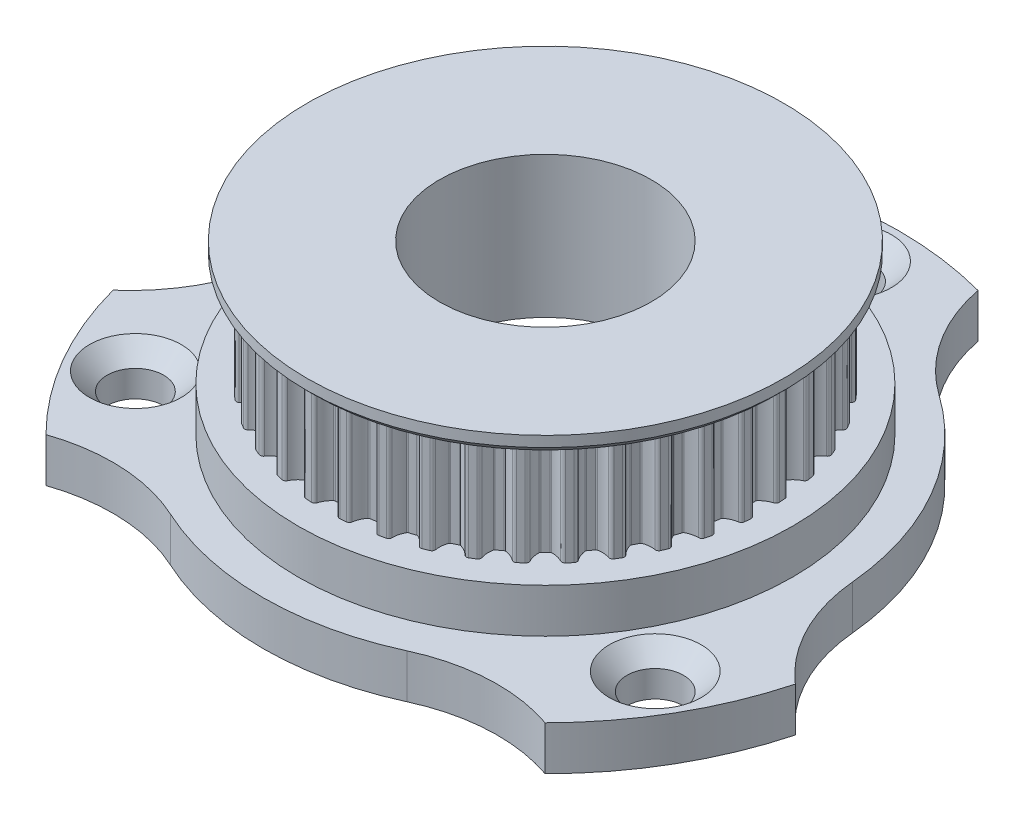
from build123d import *

# Parameters (mm, degrees)
SKETCH1_R           = 13
SKETCH1_R_2         = 1.6
BOSS_EXTRUDE1_DEPTH = 4
SKETCH2_R           = 14
BOSS_EXTRUDE2_DEPTH = 1
SKETCH3_R           = 1
BOSS_EXTRUDE3_DEPTH = 6
SKETCH4_R           = 13.5
BOSS_EXTRUDE4_DEPTH = 1
SKETCH5_R           = 6
CUT_EXTRUDE1_DEPTH  = 31.287074776
CHAMFER1_SIZE       = 0.4
CUT_EXTRUDE2_START  = -1.5
SKETCH6_R           = 14
CUT_EXTRUDE2_DEPTH  = 1.5
CHAMFER2_SIZE       = 1


with BuildPart() as part:
    # Sketch1 → Boss-Extrude1 (new body)
    with BuildSketch(Plane(origin=(0, 0, 0), x_dir=(1, 0, 0), z_dir=(0, 1, 0))):
        with BuildLine():
            ThreePointArc((-9.230769231, 13.068775743), (-6.605710649, 15.8020659), (-5.186223756, 19.315876453))
            ThreePointArc((-5.186223756, 19.315876453), (0, 20), (5.186223756, 19.315876453))
            ThreePointArc((5.186223756, 19.315876453), (6.605710649, 15.8020659), (9.230769231, 13.068775743))
            ThreePointArc((9.230769231, 13.068775743), (13.856406461, 8), (15.933276405, 1.459692779))
            ThreePointArc((15.933276405, 1.459692779), (16.987845826, -2.180319718), (19.321151583, -5.166536704))
            ThreePointArc((19.321151583, -5.166536704), (17.320508076, -10), (14.134927827, -14.149339749))
            ThreePointArc((14.134927827, -14.149339749), (10.382135177, -13.621746182), (6.702507174, -14.528468522))
            ThreePointArc((6.702507174, -14.528468522), (0, -16), (-6.702507174, -14.528468522))
            ThreePointArc((-6.702507174, -14.528468522), (-10.382135177, -13.621746182), (-14.134927827, -14.149339749))
            ThreePointArc((-14.134927827, -14.149339749), (-17.320508076, -10), (-19.321151583, -5.166536704))
            ThreePointArc((-19.321151583, -5.166536704), (-16.987845826, -2.180319718), (-15.933276405, 1.459692779))
            ThreePointArc((-15.933276405, 1.459692779), (-13.856406461, 8), (-9.230769231, 13.068775743))
        make_face()
        with Locations(Location((0, 0, 0), (0, 0, 270))):
            Circle(SKETCH1_R, mode=Mode.SUBTRACT)
        with Locations(Location((0, 17, 0), (0, 0, 270))):
            Circle(SKETCH1_R_2, mode=Mode.SUBTRACT)
        with Locations(Location((14.722431864, -8.5, 0), (0, 0, 270))):
            Circle(SKETCH1_R_2, mode=Mode.SUBTRACT)
        with Locations(Location((-14.722431864, -8.5, 0), (0, 0, 270))):
            Circle(SKETCH1_R_2, mode=Mode.SUBTRACT)
    extrude(amount=BOSS_EXTRUDE1_DEPTH)

    # Sketch2 → Boss-Extrude2 (add)
    with BuildSketch(Plane(origin=(0, 4, 0), x_dir=(1, 0, 0), z_dir=(0, 1, 0))):
        with Locations(Location((0, 0, 0), (0, 0, 270))):
            Circle(SKETCH2_R)
    extrude(amount=BOSS_EXTRUDE2_DEPTH)

    # Sketch3 → Boss-Extrude3 (add)
    with BuildSketch(Plane(origin=(0, 5, 0), x_dir=(1, 0, 0), z_dir=(0, 1, 0))):
        with BuildLine():
            ThreePointArc((0.807933899, 12.451816205), (0.688175478, 12.418909415), (0.614331313, 12.319049635))
            ThreePointArc((0.614331313, 12.319049635), (0.469945289, 12.007338122), (0.250277641, 11.74322164))
            ThreePointArc((0.250277641, 11.74322164), (0.218101357, 11.723209413), (0.180789324, 11.716605277))
            ThreePointArc((0.180789324, 11.716605277), (0, 11.718), (-0.180789324, 11.716605277))
            ThreePointArc((-0.180789324, 11.716605277), (-0.218101357, 11.723209413), (-0.250277641, 11.74322164))
            ThreePointArc((-0.250277641, 11.74322164), (-0.469945289, 12.007338122), (-0.614331313, 12.319049635))
            ThreePointArc((-0.614331313, 12.319049635), (-0.688175478, 12.418909415), (-0.807933899, 12.451816205))
            ThreePointArc((-0.807933899, 12.451816205), (-0.979012596, 12.43953449), (-1.149906315, 12.424902393))
            ThreePointArc((-1.149906315, 12.424902393), (-1.263042555, 12.373666395), (-1.320356064, 12.263484282))
            ThreePointArc((-1.320356064, 12.263484282), (-1.414202033, 11.933023504), (-1.589848288, 11.637795144))
            ThreePointArc((-1.589848288, 11.637795144), (-1.618497825, 11.61299582), (-1.654317371, 11.600636105))
            ThreePointArc((-1.654317371, 11.600636105), (-1.833099061, 11.573731975), (-2.011444386, 11.544072742))
            ThreePointArc((-2.011444386, 11.544072742), (-2.049330161, 11.544758682), (-2.084240903, 11.559491046))
            ThreePointArc((-2.084240903, 11.559491046), (-2.342520998, 11.785992224), (-2.533891814, 12.071279101))
            ThreePointArc((-2.533891814, 12.071279101), (-2.622448347, 12.158357669), (-2.745880099, 12.172124978))
            ThreePointArc((-2.745880099, 12.172124978), (-2.91293125, 12.133231867), (-3.079432019, 12.092046247))
            ThreePointArc((-3.079432019, 12.092046247), (-3.183160288, 12.023742642), (-3.222531894, 11.905951246))
            ThreePointArc((-3.222531894, 11.905951246), (-3.263527007, 11.564878245), (-3.390826875, 11.245807507))
            ThreePointArc((-3.390826875, 11.245807507), (-3.41524422, 11.21683173), (-3.448689282, 11.199020771))
            ThreePointArc((-3.448689282, 11.199020771), (-3.62106114, 11.144480258), (-3.792571012, 11.087286824))
            ThreePointArc((-3.792571012, 11.087286824), (-3.830097654, 11.082037678), (-3.866883236, 11.091127419))
            ThreePointArc((-3.866883236, 11.091127419), (-4.157416066, 11.274436083), (-4.39105949, 11.526273614))
            ThreePointArc((-4.39105949, 11.526273614), (-4.492147834, 11.598426806), (-4.616213618, 11.592715637))
            ThreePointArc((-4.616213618, 11.592715637), (-4.775123869, 11.528168807), (-4.933131886, 11.461443792))
            ThreePointArc((-4.933131886, 11.461443792), (-5.024898051, 11.377754441), (-5.045358292, 11.255254176))
            ThreePointArc((-5.045358292, 11.255254176), (-5.032493116, 10.911967301), (-5.10831205, 10.576910767))
            ThreePointArc((-5.10831205, 10.576910767), (-5.127895967, 10.544472015), (-5.158143018, 10.521648379))
            ThreePointArc((-5.158143018, 10.521648379), (-5.319860676, 10.44081445), (-5.480311952, 10.357495108))
            ThreePointArc((-5.480311952, 10.357495108), (-5.516555432, 10.346440127), (-5.554310072, 10.349663425))
            ThreePointArc((-5.554310072, 10.349663425), (-5.869941753, 10.485265908), (-6.140104708, 10.697453017))
            ThreePointArc((-6.140104708, 10.697453017), (-6.251235732, 10.752904183), (-6.372880637, 10.727855162))
            ThreePointArc((-6.372880637, 10.727855162), (-6.519737091, 10.639243971), (-6.665361675, 10.548622552))
            ThreePointArc((-6.665361675, 10.548622552), (-6.742906147, 10.451608165), (-6.743951225, 10.327415395))
            ThreePointArc((-6.743951225, 10.327415395), (-6.677542542, 9.990367508), (-6.70001363, 9.647575382))
            ThreePointArc((-6.70001363, 9.647575382), (-6.714281898, 9.612472405), (-6.740586153, 9.585198084))
            ThreePointArc((-6.740586153, 9.585198084), (-6.887667586, 9.48006114), (-7.033109424, 9.372667487))
            ThreePointArc((-7.033109424, 9.372667487), (-7.067177307, 9.356078882), (-7.104971359, 9.353356369))
            ThreePointArc((-7.104971359, 9.353356369), (-7.437929992, 9.437913687), (-7.73796017, 9.605225624))
            ThreePointArc((-7.73796017, 9.605225624), (-7.85639746, 9.642609371), (-7.972626185, 9.59883929))
            ThreePointArc((-7.972626185, 9.59883929), (-8.103812747, 9.488345639), (-8.233468138, 9.376059216))
            ThreePointArc((-8.233468138, 9.376059216), (-8.294881515, 9.268108609), (-8.276485697, 9.145281372))
            ThreePointArc((-8.276485697, 9.145281372), (-8.158168709, 8.82277171), (-8.126738638, 8.480684672))
            ThreePointArc((-8.126738638, 8.480684672), (-8.135339924, 8.443781822), (-8.157053687, 8.412728401))
            ThreePointArc((-8.157053687, 8.412728401), (-8.285877262, 8.285877262), (-8.412728401, 8.157053687))
            ThreePointArc((-8.412728401, 8.157053687), (-8.443781822, 8.135339924), (-8.480684672, 8.126738638))
            ThreePointArc((-8.480684672, 8.126738638), (-8.82277171, 8.158168709), (-9.145281372, 8.276485697))
            ThreePointArc((-9.145281372, 8.276485697), (-9.268108609, 8.294881515), (-9.376059216, 8.233468138))
            ThreePointArc((-9.376059216, 8.233468138), (-9.488345639, 8.103812747), (-9.59883929, 7.972626185))
            ThreePointArc((-9.59883929, 7.972626185), (-9.642609371, 7.85639746), (-9.605225624, 7.73796017))
            ThreePointArc((-9.605225624, 7.73796017), (-9.437913687, 7.437929992), (-9.353356369, 7.104971359))
            ThreePointArc((-9.353356369, 7.104971359), (-9.356078882, 7.067177307), (-9.372667487, 7.033109424))
            ThreePointArc((-9.372667487, 7.033109424), (-9.48006114, 6.887667586), (-9.585198084, 6.740586153))
            ThreePointArc((-9.585198084, 6.740586153), (-9.612472405, 6.714281898), (-9.647575382, 6.70001363))
            ThreePointArc((-9.647575382, 6.70001363), (-9.990367508, 6.677542542), (-10.327415395, 6.743951225))
            ThreePointArc((-10.327415395, 6.743951225), (-10.451608165, 6.742906147), (-10.548622552, 6.665361675))
            ThreePointArc((-10.548622552, 6.665361675), (-10.639243971, 6.519737091), (-10.727855162, 6.372880637))
            ThreePointArc((-10.727855162, 6.372880637), (-10.752904183, 6.251235732), (-10.697453017, 6.140104708))
            ThreePointArc((-10.697453017, 6.140104708), (-10.485265908, 5.869941753), (-10.349663425, 5.554310072))
            ThreePointArc((-10.349663425, 5.554310072), (-10.346440127, 5.516555432), (-10.357495108, 5.480311952))
            ThreePointArc((-10.357495108, 5.480311952), (-10.44081445, 5.319860676), (-10.521648379, 5.158143018))
            ThreePointArc((-10.521648379, 5.158143018), (-10.544472015, 5.127895967), (-10.576910767, 5.10831205))
            ThreePointArc((-10.576910767, 5.10831205), (-10.911967301, 5.032493116), (-11.255254176, 5.045358292))
            ThreePointArc((-11.255254176, 5.045358292), (-11.377754441, 5.024898051), (-11.461443792, 4.933131886))
            ThreePointArc((-11.461443792, 4.933131886), (-11.528168807, 4.775123869), (-11.592715637, 4.616213618))
            ThreePointArc((-11.592715637, 4.616213618), (-11.598426806, 4.492147834), (-11.526273614, 4.39105949))
            ThreePointArc((-11.526273614, 4.39105949), (-11.274436083, 4.157416066), (-11.091127419, 3.866883236))
            ThreePointArc((-11.091127419, 3.866883236), (-11.082037678, 3.830097654), (-11.087286824, 3.792571012))
            ThreePointArc((-11.087286824, 3.792571012), (-11.144480258, 3.62106114), (-11.199020771, 3.448689282))
            ThreePointArc((-11.199020771, 3.448689282), (-11.21683173, 3.41524422), (-11.245807507, 3.390826875))
            ThreePointArc((-11.245807507, 3.390826875), (-11.564878245, 3.263527007), (-11.905951246, 3.222531894))
            ThreePointArc((-11.905951246, 3.222531894), (-12.023742642, 3.183160288), (-12.092046247, 3.079432019))
            ThreePointArc((-12.092046247, 3.079432019), (-12.133231867, 2.91293125), (-12.172124978, 2.745880099))
            ThreePointArc((-12.172124978, 2.745880099), (-12.158357669, 2.622448347), (-12.071279101, 2.533891814))
            ThreePointArc((-12.071279101, 2.533891814), (-11.785992224, 2.342520998), (-11.559491046, 2.084240903))
            ThreePointArc((-11.559491046, 2.084240903), (-11.544758682, 2.049330161), (-11.544072742, 2.011444386))
            ThreePointArc((-11.544072742, 2.011444386), (-11.573731975, 1.833099061), (-11.600636105, 1.654317371))
            ThreePointArc((-11.600636105, 1.654317371), (-11.61299582, 1.618497825), (-11.637795144, 1.589848288))
            ThreePointArc((-11.637795144, 1.589848288), (-11.933023504, 1.414202033), (-12.263484282, 1.320356064))
            ThreePointArc((-12.263484282, 1.320356064), (-12.373666395, 1.263042555), (-12.424902393, 1.149906315))
            ThreePointArc((-12.424902393, 1.149906315), (-12.43953449, 0.979012596), (-12.451816205, 0.807933899))
            ThreePointArc((-12.451816205, 0.807933899), (-12.418909415, 0.688175478), (-12.319049635, 0.614331313))
            ThreePointArc((-12.319049635, 0.614331313), (-12.007338122, 0.469945289), (-11.74322164, 0.250277641))
            ThreePointArc((-11.74322164, 0.250277641), (-11.723209413, 0.218101357), (-11.716605277, 0.180789324))
            ThreePointArc((-11.716605277, 0.180789324), (-11.718, 0), (-11.716605277, -0.180789324))
            ThreePointArc((-11.716605277, -0.180789324), (-11.723209413, -0.218101357), (-11.74322164, -0.250277641))
            ThreePointArc((-11.74322164, -0.250277641), (-12.007338122, -0.469945289), (-12.319049635, -0.614331313))
            ThreePointArc((-12.319049635, -0.614331313), (-12.418909415, -0.688175478), (-12.451816205, -0.807933899))
            ThreePointArc((-12.451816205, -0.807933899), (-12.43953449, -0.979012596), (-12.424902393, -1.149906315))
            ThreePointArc((-12.424902393, -1.149906315), (-12.373666395, -1.263042555), (-12.263484282, -1.320356064))
            ThreePointArc((-12.263484282, -1.320356064), (-11.933023504, -1.414202033), (-11.637795144, -1.589848288))
            ThreePointArc((-11.637795144, -1.589848288), (-11.61299582, -1.618497825), (-11.600636105, -1.654317371))
            ThreePointArc((-11.600636105, -1.654317371), (-11.573731975, -1.833099061), (-11.544072742, -2.011444386))
            ThreePointArc((-11.544072742, -2.011444386), (-11.544758682, -2.049330161), (-11.559491046, -2.084240903))
            ThreePointArc((-11.559491046, -2.084240903), (-11.785992224, -2.342520998), (-12.071279101, -2.533891814))
            ThreePointArc((-12.071279101, -2.533891814), (-12.158357669, -2.622448347), (-12.172124978, -2.745880099))
            ThreePointArc((-12.172124978, -2.745880099), (-12.133231867, -2.91293125), (-12.092046247, -3.079432019))
            ThreePointArc((-12.092046247, -3.079432019), (-12.023742642, -3.183160288), (-11.905951246, -3.222531894))
            ThreePointArc((-11.905951246, -3.222531894), (-11.564878245, -3.263527007), (-11.245807507, -3.390826875))
            ThreePointArc((-11.245807507, -3.390826875), (-11.21683173, -3.41524422), (-11.199020771, -3.448689282))
            ThreePointArc((-11.199020771, -3.448689282), (-11.144480258, -3.62106114), (-11.087286824, -3.792571012))
            ThreePointArc((-11.087286824, -3.792571012), (-11.082037678, -3.830097654), (-11.091127419, -3.866883236))
            ThreePointArc((-11.091127419, -3.866883236), (-11.274436083, -4.157416066), (-11.526273614, -4.39105949))
            ThreePointArc((-11.526273614, -4.39105949), (-11.598426806, -4.492147834), (-11.592715637, -4.616213618))
            ThreePointArc((-11.592715637, -4.616213618), (-11.528168807, -4.775123869), (-11.461443792, -4.933131886))
            ThreePointArc((-11.461443792, -4.933131886), (-11.377754441, -5.024898051), (-11.255254176, -5.045358292))
            ThreePointArc((-11.255254176, -5.045358292), (-10.911967301, -5.032493116), (-10.576910767, -5.10831205))
            ThreePointArc((-10.576910767, -5.10831205), (-10.544472015, -5.127895967), (-10.521648379, -5.158143018))
            ThreePointArc((-10.521648379, -5.158143018), (-10.44081445, -5.319860676), (-10.357495108, -5.480311952))
            ThreePointArc((-10.357495108, -5.480311952), (-10.346440127, -5.516555432), (-10.349663425, -5.554310072))
            ThreePointArc((-10.349663425, -5.554310072), (-10.485265908, -5.869941753), (-10.697453017, -6.140104708))
            ThreePointArc((-10.697453017, -6.140104708), (-10.752904183, -6.251235732), (-10.727855162, -6.372880637))
            ThreePointArc((-10.727855162, -6.372880637), (-10.639243971, -6.519737091), (-10.548622552, -6.665361675))
            ThreePointArc((-10.548622552, -6.665361675), (-10.451608165, -6.742906147), (-10.327415395, -6.743951225))
            ThreePointArc((-10.327415395, -6.743951225), (-9.990367508, -6.677542542), (-9.647575382, -6.70001363))
            ThreePointArc((-9.647575382, -6.70001363), (-9.612472405, -6.714281898), (-9.585198084, -6.740586153))
            ThreePointArc((-9.585198084, -6.740586153), (-9.48006114, -6.887667586), (-9.372667487, -7.033109424))
            ThreePointArc((-9.372667487, -7.033109424), (-9.356078882, -7.067177307), (-9.353356369, -7.104971359))
            ThreePointArc((-9.353356369, -7.104971359), (-9.437913687, -7.437929992), (-9.605225624, -7.73796017))
            ThreePointArc((-9.605225624, -7.73796017), (-9.642609371, -7.85639746), (-9.59883929, -7.972626185))
            ThreePointArc((-9.59883929, -7.972626185), (-9.488345639, -8.103812747), (-9.376059216, -8.233468138))
            ThreePointArc((-9.376059216, -8.233468138), (-9.268108609, -8.294881515), (-9.145281372, -8.276485697))
            ThreePointArc((-9.145281372, -8.276485697), (-8.82277171, -8.158168709), (-8.480684672, -8.126738638))
            ThreePointArc((-8.480684672, -8.126738638), (-8.443781822, -8.135339924), (-8.412728401, -8.157053687))
            ThreePointArc((-8.412728401, -8.157053687), (-8.285877262, -8.285877262), (-8.157053687, -8.412728401))
            ThreePointArc((-8.157053687, -8.412728401), (-8.135339924, -8.443781822), (-8.126738638, -8.480684672))
            ThreePointArc((-8.126738638, -8.480684672), (-8.158168709, -8.82277171), (-8.276485697, -9.145281372))
            ThreePointArc((-8.276485697, -9.145281372), (-8.294881515, -9.268108609), (-8.233468138, -9.376059216))
            ThreePointArc((-8.233468138, -9.376059216), (-8.103812747, -9.488345639), (-7.972626185, -9.59883929))
            ThreePointArc((-7.972626185, -9.59883929), (-7.85639746, -9.642609371), (-7.73796017, -9.605225624))
            ThreePointArc((-7.73796017, -9.605225624), (-7.437929992, -9.437913687), (-7.104971359, -9.353356369))
            ThreePointArc((-7.104971359, -9.353356369), (-7.067177307, -9.356078882), (-7.033109424, -9.372667487))
            ThreePointArc((-7.033109424, -9.372667487), (-6.887667586, -9.48006114), (-6.740586153, -9.585198084))
            ThreePointArc((-6.740586153, -9.585198084), (-6.714281898, -9.612472405), (-6.70001363, -9.647575382))
            ThreePointArc((-6.70001363, -9.647575382), (-6.677542542, -9.990367508), (-6.743951225, -10.327415395))
            ThreePointArc((-6.743951225, -10.327415395), (-6.742906147, -10.451608165), (-6.665361675, -10.548622552))
            ThreePointArc((-6.665361675, -10.548622552), (-6.519737091, -10.639243971), (-6.372880637, -10.727855162))
            ThreePointArc((-6.372880637, -10.727855162), (-6.251235732, -10.752904183), (-6.140104708, -10.697453017))
            ThreePointArc((-6.140104708, -10.697453017), (-5.869941753, -10.485265908), (-5.554310072, -10.349663425))
            ThreePointArc((-5.554310072, -10.349663425), (-5.516555432, -10.346440127), (-5.480311952, -10.357495108))
            ThreePointArc((-5.480311952, -10.357495108), (-5.319860676, -10.44081445), (-5.158143018, -10.521648379))
            ThreePointArc((-5.158143018, -10.521648379), (-5.127895967, -10.544472015), (-5.10831205, -10.576910767))
            ThreePointArc((-5.10831205, -10.576910767), (-5.032493116, -10.911967301), (-5.045358292, -11.255254176))
            ThreePointArc((-5.045358292, -11.255254176), (-5.024898051, -11.377754441), (-4.933131886, -11.461443792))
            ThreePointArc((-4.933131886, -11.461443792), (-4.775123869, -11.528168807), (-4.616213618, -11.592715637))
            ThreePointArc((-4.616213618, -11.592715637), (-4.492147834, -11.598426806), (-4.39105949, -11.526273614))
            ThreePointArc((-4.39105949, -11.526273614), (-4.157416066, -11.274436083), (-3.866883236, -11.091127419))
            ThreePointArc((-3.866883236, -11.091127419), (-3.830097654, -11.082037678), (-3.792571012, -11.087286824))
            ThreePointArc((-3.792571012, -11.087286824), (-3.62106114, -11.144480258), (-3.448689282, -11.199020771))
            ThreePointArc((-3.448689282, -11.199020771), (-3.41524422, -11.21683173), (-3.390826875, -11.245807507))
            ThreePointArc((-3.390826875, -11.245807507), (-3.263527007, -11.564878245), (-3.222531894, -11.905951246))
            ThreePointArc((-3.222531894, -11.905951246), (-3.183160288, -12.023742642), (-3.079432019, -12.092046247))
            ThreePointArc((-3.079432019, -12.092046247), (-2.91293125, -12.133231867), (-2.745880099, -12.172124978))
            ThreePointArc((-2.745880099, -12.172124978), (-2.622448347, -12.158357669), (-2.533891814, -12.071279101))
            ThreePointArc((-2.533891814, -12.071279101), (-2.342520998, -11.785992224), (-2.084240903, -11.559491046))
            ThreePointArc((-2.084240903, -11.559491046), (-2.049330161, -11.544758682), (-2.011444386, -11.544072742))
            ThreePointArc((-2.011444386, -11.544072742), (-1.833099061, -11.573731975), (-1.654317371, -11.600636105))
            ThreePointArc((-1.654317371, -11.600636105), (-1.618497825, -11.61299582), (-1.589848288, -11.637795144))
            ThreePointArc((-1.589848288, -11.637795144), (-1.414202033, -11.933023504), (-1.320356064, -12.263484282))
            ThreePointArc((-1.320356064, -12.263484282), (-1.263042555, -12.373666395), (-1.149906315, -12.424902393))
            ThreePointArc((-1.149906315, -12.424902393), (-0.979012596, -12.43953449), (-0.807933899, -12.451816205))
            ThreePointArc((-0.807933899, -12.451816205), (-0.688175478, -12.418909415), (-0.614331313, -12.319049635))
            ThreePointArc((-0.614331313, -12.319049635), (-0.469945289, -12.007338122), (-0.250277641, -11.74322164))
            ThreePointArc((-0.250277641, -11.74322164), (-0.218101357, -11.723209413), (-0.180789324, -11.716605277))
            ThreePointArc((-0.180789324, -11.716605277), (0, -11.718), (0.180789324, -11.716605277))
            ThreePointArc((0.180789324, -11.716605277), (0.218101357, -11.723209413), (0.250277641, -11.74322164))
            ThreePointArc((0.250277641, -11.74322164), (0.469945289, -12.007338122), (0.614331313, -12.319049635))
            ThreePointArc((0.614331313, -12.319049635), (0.688175478, -12.418909415), (0.807933899, -12.451816205))
            ThreePointArc((0.807933899, -12.451816205), (0.979012596, -12.43953449), (1.149906315, -12.424902393))
            ThreePointArc((1.149906315, -12.424902393), (1.263042555, -12.373666395), (1.320356064, -12.263484282))
            ThreePointArc((1.320356064, -12.263484282), (1.414202033, -11.933023504), (1.589848288, -11.637795144))
            ThreePointArc((1.589848288, -11.637795144), (1.618497825, -11.61299582), (1.654317371, -11.600636105))
            ThreePointArc((1.654317371, -11.600636105), (1.833099061, -11.573731975), (2.011444386, -11.544072742))
            ThreePointArc((2.011444386, -11.544072742), (2.049330161, -11.544758682), (2.084240903, -11.559491046))
            ThreePointArc((2.084240903, -11.559491046), (2.342520998, -11.785992224), (2.533891814, -12.071279101))
            ThreePointArc((2.533891814, -12.071279101), (2.622448347, -12.158357669), (2.745880099, -12.172124978))
            ThreePointArc((2.745880099, -12.172124978), (2.91293125, -12.133231867), (3.079432019, -12.092046247))
            ThreePointArc((3.079432019, -12.092046247), (3.183160288, -12.023742642), (3.222531894, -11.905951246))
            ThreePointArc((3.222531894, -11.905951246), (3.263527007, -11.564878245), (3.390826875, -11.245807507))
            ThreePointArc((3.390826875, -11.245807507), (3.41524422, -11.21683173), (3.448689282, -11.199020771))
            ThreePointArc((3.448689282, -11.199020771), (3.62106114, -11.144480258), (3.792571012, -11.087286824))
            ThreePointArc((3.792571012, -11.087286824), (3.830097654, -11.082037678), (3.866883236, -11.091127419))
            ThreePointArc((3.866883236, -11.091127419), (4.157416066, -11.274436083), (4.39105949, -11.526273614))
            ThreePointArc((4.39105949, -11.526273614), (4.492147834, -11.598426806), (4.616213618, -11.592715637))
            ThreePointArc((4.616213618, -11.592715637), (4.775123869, -11.528168807), (4.933131886, -11.461443792))
            ThreePointArc((4.933131886, -11.461443792), (5.024898051, -11.377754441), (5.045358292, -11.255254176))
            ThreePointArc((5.045358292, -11.255254176), (5.032493116, -10.911967301), (5.10831205, -10.576910767))
            ThreePointArc((5.10831205, -10.576910767), (5.127895967, -10.544472015), (5.158143018, -10.521648379))
            ThreePointArc((5.158143018, -10.521648379), (5.319860676, -10.44081445), (5.480311952, -10.357495108))
            ThreePointArc((5.480311952, -10.357495108), (5.516555432, -10.346440127), (5.554310072, -10.349663425))
            ThreePointArc((5.554310072, -10.349663425), (5.869941753, -10.485265908), (6.140104708, -10.697453017))
            ThreePointArc((6.140104708, -10.697453017), (6.251235732, -10.752904183), (6.372880637, -10.727855162))
            ThreePointArc((6.372880637, -10.727855162), (6.519737091, -10.639243971), (6.665361675, -10.548622552))
            ThreePointArc((6.665361675, -10.548622552), (6.742906147, -10.451608165), (6.743951225, -10.327415395))
            ThreePointArc((6.743951225, -10.327415395), (6.677542542, -9.990367508), (6.70001363, -9.647575382))
            ThreePointArc((6.70001363, -9.647575382), (6.714281898, -9.612472405), (6.740586153, -9.585198084))
            ThreePointArc((6.740586153, -9.585198084), (6.887667586, -9.48006114), (7.033109424, -9.372667487))
            ThreePointArc((7.033109424, -9.372667487), (7.067177307, -9.356078882), (7.104971359, -9.353356369))
            ThreePointArc((7.104971359, -9.353356369), (7.437929992, -9.437913687), (7.73796017, -9.605225624))
            ThreePointArc((7.73796017, -9.605225624), (7.85639746, -9.642609371), (7.972626185, -9.59883929))
            ThreePointArc((7.972626185, -9.59883929), (8.103812747, -9.488345639), (8.233468138, -9.376059216))
            ThreePointArc((8.233468138, -9.376059216), (8.294881515, -9.268108609), (8.276485697, -9.145281372))
            ThreePointArc((8.276485697, -9.145281372), (8.158168709, -8.82277171), (8.126738638, -8.480684672))
            ThreePointArc((8.126738638, -8.480684672), (8.135339924, -8.443781822), (8.157053687, -8.412728401))
            ThreePointArc((8.157053687, -8.412728401), (8.285877262, -8.285877262), (8.412728401, -8.157053687))
            ThreePointArc((8.412728401, -8.157053687), (8.443781822, -8.135339924), (8.480684672, -8.126738638))
            ThreePointArc((8.480684672, -8.126738638), (8.82277171, -8.158168709), (9.145281372, -8.276485697))
            ThreePointArc((9.145281372, -8.276485697), (9.268108609, -8.294881515), (9.376059216, -8.233468138))
            ThreePointArc((9.376059216, -8.233468138), (9.488345639, -8.103812747), (9.59883929, -7.972626185))
            ThreePointArc((9.59883929, -7.972626185), (9.642609371, -7.85639746), (9.605225624, -7.73796017))
            ThreePointArc((9.605225624, -7.73796017), (9.437913687, -7.437929992), (9.353356369, -7.104971359))
            ThreePointArc((9.353356369, -7.104971359), (9.356078882, -7.067177307), (9.372667487, -7.033109424))
            ThreePointArc((9.372667487, -7.033109424), (9.48006114, -6.887667586), (9.585198084, -6.740586153))
            ThreePointArc((9.585198084, -6.740586153), (9.612472405, -6.714281898), (9.647575382, -6.70001363))
            ThreePointArc((9.647575382, -6.70001363), (9.990367508, -6.677542542), (10.327415395, -6.743951225))
            ThreePointArc((10.327415395, -6.743951225), (10.451608165, -6.742906147), (10.548622552, -6.665361675))
            ThreePointArc((10.548622552, -6.665361675), (10.639243971, -6.519737091), (10.727855162, -6.372880637))
            ThreePointArc((10.727855162, -6.372880637), (10.752904183, -6.251235732), (10.697453017, -6.140104708))
            ThreePointArc((10.697453017, -6.140104708), (10.485265908, -5.869941753), (10.349663425, -5.554310072))
            ThreePointArc((10.349663425, -5.554310072), (10.346440127, -5.516555432), (10.357495108, -5.480311952))
            ThreePointArc((10.357495108, -5.480311952), (10.44081445, -5.319860676), (10.521648379, -5.158143018))
            ThreePointArc((10.521648379, -5.158143018), (10.544472015, -5.127895967), (10.576910767, -5.10831205))
            ThreePointArc((10.576910767, -5.10831205), (10.911967301, -5.032493116), (11.255254176, -5.045358292))
            ThreePointArc((11.255254176, -5.045358292), (11.377754441, -5.024898051), (11.461443792, -4.933131886))
            ThreePointArc((11.461443792, -4.933131886), (11.528168807, -4.775123869), (11.592715637, -4.616213618))
            ThreePointArc((11.592715637, -4.616213618), (11.598426806, -4.492147834), (11.526273614, -4.39105949))
            ThreePointArc((11.526273614, -4.39105949), (11.274436083, -4.157416066), (11.091127419, -3.866883236))
            ThreePointArc((11.091127419, -3.866883236), (11.082037678, -3.830097654), (11.087286824, -3.792571012))
            ThreePointArc((11.087286824, -3.792571012), (11.144480258, -3.62106114), (11.199020771, -3.448689282))
            ThreePointArc((11.199020771, -3.448689282), (11.21683173, -3.41524422), (11.245807507, -3.390826875))
            ThreePointArc((11.245807507, -3.390826875), (11.564878245, -3.263527007), (11.905951246, -3.222531894))
            ThreePointArc((11.905951246, -3.222531894), (12.023742642, -3.183160288), (12.092046247, -3.079432019))
            ThreePointArc((12.092046247, -3.079432019), (12.133231867, -2.91293125), (12.172124978, -2.745880099))
            ThreePointArc((12.172124978, -2.745880099), (12.158357669, -2.622448347), (12.071279101, -2.533891814))
            ThreePointArc((12.071279101, -2.533891814), (11.785992224, -2.342520998), (11.559491046, -2.084240903))
            ThreePointArc((11.559491046, -2.084240903), (11.544758682, -2.049330161), (11.544072742, -2.011444386))
            ThreePointArc((11.544072742, -2.011444386), (11.573731975, -1.833099061), (11.600636105, -1.654317371))
            ThreePointArc((11.600636105, -1.654317371), (11.61299582, -1.618497825), (11.637795144, -1.589848288))
            ThreePointArc((11.637795144, -1.589848288), (11.933023504, -1.414202033), (12.263484282, -1.320356064))
            ThreePointArc((12.263484282, -1.320356064), (12.373666395, -1.263042555), (12.424902393, -1.149906315))
            ThreePointArc((12.424902393, -1.149906315), (12.43953449, -0.979012596), (12.451816205, -0.807933899))
            ThreePointArc((12.451816205, -0.807933899), (12.418909415, -0.688175478), (12.319049635, -0.614331313))
            ThreePointArc((12.319049635, -0.614331313), (12.007338122, -0.469945289), (11.74322164, -0.250277641))
            ThreePointArc((11.74322164, -0.250277641), (11.723209413, -0.218101357), (11.716605277, -0.180789324))
            ThreePointArc((11.716605277, -0.180789324), (11.718, 0), (11.716605277, 0.180789324))
            ThreePointArc((11.716605277, 0.180789324), (11.723209413, 0.218101357), (11.74322164, 0.250277641))
            ThreePointArc((11.74322164, 0.250277641), (12.007338122, 0.469945289), (12.319049635, 0.614331313))
            ThreePointArc((12.319049635, 0.614331313), (12.418909415, 0.688175478), (12.451816205, 0.807933899))
            ThreePointArc((12.451816205, 0.807933899), (12.43953449, 0.979012596), (12.424902393, 1.149906315))
            ThreePointArc((12.424902393, 1.149906315), (12.373666395, 1.263042555), (12.263484282, 1.320356064))
            ThreePointArc((12.263484282, 1.320356064), (11.933023504, 1.414202033), (11.637795144, 1.589848288))
            ThreePointArc((11.637795144, 1.589848288), (11.61299582, 1.618497825), (11.600636105, 1.654317371))
            ThreePointArc((11.600636105, 1.654317371), (11.573731975, 1.833099061), (11.544072742, 2.011444386))
            ThreePointArc((11.544072742, 2.011444386), (11.544758682, 2.049330161), (11.559491046, 2.084240903))
            ThreePointArc((11.559491046, 2.084240903), (11.785992224, 2.342520998), (12.071279101, 2.533891814))
            ThreePointArc((12.071279101, 2.533891814), (12.158357669, 2.622448347), (12.172124978, 2.745880099))
            ThreePointArc((12.172124978, 2.745880099), (12.133231867, 2.91293125), (12.092046247, 3.079432019))
            ThreePointArc((12.092046247, 3.079432019), (12.023742642, 3.183160288), (11.905951246, 3.222531894))
            ThreePointArc((11.905951246, 3.222531894), (11.564878245, 3.263527007), (11.245807507, 3.390826875))
            ThreePointArc((11.245807507, 3.390826875), (11.21683173, 3.41524422), (11.199020771, 3.448689282))
            ThreePointArc((11.199020771, 3.448689282), (11.144480258, 3.62106114), (11.087286824, 3.792571012))
            ThreePointArc((11.087286824, 3.792571012), (11.082037678, 3.830097654), (11.091127419, 3.866883236))
            ThreePointArc((11.091127419, 3.866883236), (11.274436083, 4.157416066), (11.526273614, 4.39105949))
            ThreePointArc((11.526273614, 4.39105949), (11.598426806, 4.492147834), (11.592715637, 4.616213618))
            ThreePointArc((11.592715637, 4.616213618), (11.528168807, 4.775123869), (11.461443792, 4.933131886))
            ThreePointArc((11.461443792, 4.933131886), (11.377754441, 5.024898051), (11.255254176, 5.045358292))
            ThreePointArc((11.255254176, 5.045358292), (10.911967301, 5.032493116), (10.576910767, 5.10831205))
            ThreePointArc((10.576910767, 5.10831205), (10.544472015, 5.127895967), (10.521648379, 5.158143018))
            ThreePointArc((10.521648379, 5.158143018), (10.44081445, 5.319860676), (10.357495108, 5.480311952))
            ThreePointArc((10.357495108, 5.480311952), (10.346440127, 5.516555432), (10.349663425, 5.554310072))
            ThreePointArc((10.349663425, 5.554310072), (10.485265908, 5.869941753), (10.697453017, 6.140104708))
            ThreePointArc((10.697453017, 6.140104708), (10.752904183, 6.251235732), (10.727855162, 6.372880637))
            ThreePointArc((10.727855162, 6.372880637), (10.639243971, 6.519737091), (10.548622552, 6.665361675))
            ThreePointArc((10.548622552, 6.665361675), (10.451608165, 6.742906147), (10.327415395, 6.743951225))
            ThreePointArc((10.327415395, 6.743951225), (9.990367508, 6.677542542), (9.647575382, 6.70001363))
            ThreePointArc((9.647575382, 6.70001363), (9.612472405, 6.714281898), (9.585198084, 6.740586153))
            ThreePointArc((9.585198084, 6.740586153), (9.48006114, 6.887667586), (9.372667487, 7.033109424))
            ThreePointArc((9.372667487, 7.033109424), (9.356078882, 7.067177307), (9.353356369, 7.104971359))
            ThreePointArc((9.353356369, 7.104971359), (9.437913687, 7.437929992), (9.605225624, 7.73796017))
            ThreePointArc((9.605225624, 7.73796017), (9.642609371, 7.85639746), (9.59883929, 7.972626185))
            ThreePointArc((9.59883929, 7.972626185), (9.488345639, 8.103812747), (9.376059216, 8.233468138))
            ThreePointArc((9.376059216, 8.233468138), (9.268108609, 8.294881515), (9.145281372, 8.276485697))
            ThreePointArc((9.145281372, 8.276485697), (8.82277171, 8.158168709), (8.480684672, 8.126738638))
            ThreePointArc((8.480684672, 8.126738638), (8.443781822, 8.135339924), (8.412728401, 8.157053687))
            ThreePointArc((8.412728401, 8.157053687), (8.285877262, 8.285877262), (8.157053687, 8.412728401))
            ThreePointArc((8.157053687, 8.412728401), (8.135339924, 8.443781822), (8.126738638, 8.480684672))
            ThreePointArc((8.126738638, 8.480684672), (8.158168709, 8.82277171), (8.276485697, 9.145281372))
            ThreePointArc((8.276485697, 9.145281372), (8.294881515, 9.268108609), (8.233468138, 9.376059216))
            ThreePointArc((8.233468138, 9.376059216), (8.103812747, 9.488345639), (7.972626185, 9.59883929))
            ThreePointArc((7.972626185, 9.59883929), (7.85639746, 9.642609371), (7.73796017, 9.605225624))
            ThreePointArc((7.73796017, 9.605225624), (7.437929992, 9.437913687), (7.104971359, 9.353356369))
            ThreePointArc((7.104971359, 9.353356369), (7.067177307, 9.356078882), (7.033109424, 9.372667487))
            ThreePointArc((7.033109424, 9.372667487), (6.887667586, 9.48006114), (6.740586153, 9.585198084))
            ThreePointArc((6.740586153, 9.585198084), (6.714281898, 9.612472405), (6.70001363, 9.647575382))
            ThreePointArc((6.70001363, 9.647575382), (6.677542542, 9.990367508), (6.743951225, 10.327415395))
            ThreePointArc((6.743951225, 10.327415395), (6.742906147, 10.451608165), (6.665361675, 10.548622552))
            ThreePointArc((6.665361675, 10.548622552), (6.519737091, 10.639243971), (6.372880637, 10.727855162))
            ThreePointArc((6.372880637, 10.727855162), (6.251235732, 10.752904183), (6.140104708, 10.697453017))
            ThreePointArc((6.140104708, 10.697453017), (5.869941753, 10.485265908), (5.554310072, 10.349663425))
            ThreePointArc((5.554310072, 10.349663425), (5.516555432, 10.346440127), (5.480311952, 10.357495108))
            ThreePointArc((5.480311952, 10.357495108), (5.319860676, 10.44081445), (5.158143018, 10.521648379))
            ThreePointArc((5.158143018, 10.521648379), (5.127895967, 10.544472015), (5.10831205, 10.576910767))
            ThreePointArc((5.10831205, 10.576910767), (5.032493116, 10.911967301), (5.045358292, 11.255254176))
            ThreePointArc((5.045358292, 11.255254176), (5.024898051, 11.377754441), (4.933131886, 11.461443792))
            ThreePointArc((4.933131886, 11.461443792), (4.775123869, 11.528168807), (4.616213618, 11.592715637))
            ThreePointArc((4.616213618, 11.592715637), (4.492147834, 11.598426806), (4.39105949, 11.526273614))
            ThreePointArc((4.39105949, 11.526273614), (4.157416066, 11.274436083), (3.866883236, 11.091127419))
            ThreePointArc((3.866883236, 11.091127419), (3.830097654, 11.082037678), (3.792571012, 11.087286824))
            ThreePointArc((3.792571012, 11.087286824), (3.62106114, 11.144480258), (3.448689282, 11.199020771))
            ThreePointArc((3.448689282, 11.199020771), (3.41524422, 11.21683173), (3.390826875, 11.245807507))
            ThreePointArc((3.390826875, 11.245807507), (3.263527007, 11.564878245), (3.222531894, 11.905951246))
            ThreePointArc((3.222531894, 11.905951246), (3.183160288, 12.023742642), (3.079432019, 12.092046247))
            ThreePointArc((3.079432019, 12.092046247), (2.91293125, 12.133231867), (2.745880099, 12.172124978))
            ThreePointArc((2.745880099, 12.172124978), (2.622448347, 12.158357669), (2.533891814, 12.071279101))
            ThreePointArc((2.533891814, 12.071279101), (2.342520998, 11.785992224), (2.084240903, 11.559491046))
            ThreePointArc((2.084240903, 11.559491046), (2.049330161, 11.544758682), (2.011444386, 11.544072742))
            ThreePointArc((2.011444386, 11.544072742), (1.833099061, 11.573731975), (1.654317371, 11.600636105))
            ThreePointArc((1.654317371, 11.600636105), (1.618497825, 11.61299582), (1.589848288, 11.637795144))
            ThreePointArc((1.589848288, 11.637795144), (1.414202033, 11.933023504), (1.320356064, 12.263484282))
            ThreePointArc((1.320356064, 12.263484282), (1.263042555, 12.373666395), (1.149906315, 12.424902393))
            ThreePointArc((1.149906315, 12.424902393), (0.979012596, 12.43953449), (0.807933899, 12.451816205))
        make_face()
        with Locations(Location((0, 0, 0), (0, 0, 270))):
            Circle(SKETCH3_R, mode=Mode.SUBTRACT)
    extrude(amount=BOSS_EXTRUDE3_DEPTH)

    # Sketch4 → Boss-Extrude4 (add)
    with BuildSketch(Plane(origin=(0, 11, 0), x_dir=(1, 0, 0), z_dir=(0, 1, 0))):
        with Locations(Location((0, 0, 0), (0, 0, 270))):
            Circle(SKETCH4_R)
    extrude(amount=BOSS_EXTRUDE4_DEPTH)

    # Sketch5 → Cut-Extrude1 (cut, through all)
    with BuildSketch(Plane(origin=(0, 12, 0), x_dir=(1, 0, 0), z_dir=(0, 1, 0))):
        with Locations(Location((0, 0, 0), (0, 0, 270))):
            Circle(SKETCH5_R)
    extrude(amount=-CUT_EXTRUDE1_DEPTH, mode=Mode.SUBTRACT)

    # Chamfer1
    chamfer1_edges = [part.edges().sort_by_distance(p)[0] for p in [
        (0, 11, -13.5),
    ]]
    chamfer(chamfer1_edges, length=CHAMFER1_SIZE)

    # Sketch6 → Cut-Extrude2 (cut)
    with BuildSketch(Plane(origin=(0, 4, 0), x_dir=(1, 0, 0), z_dir=(0, 1, 0)).offset(CUT_EXTRUDE2_START)):
        with BuildLine():
            ThreePointArc((-9.230769231, 13.068775743), (-13.856406461, 8), (-15.933276405, 1.459692779))
            ThreePointArc((-15.933276405, 1.459692779), (-16.987845826, -2.180319718), (-19.321151583, -5.166536704))
            ThreePointArc((-19.321151583, -5.166536704), (-17.320508076, -10), (-14.134927827, -14.149339749))
            ThreePointArc((-14.134927827, -14.149339749), (-10.382135177, -13.621746182), (-6.702507174, -14.528468522))
            ThreePointArc((-6.702507174, -14.528468522), (0, -16), (6.702507174, -14.528468522))
            ThreePointArc((6.702507174, -14.528468522), (10.382135177, -13.621746182), (14.134927827, -14.149339749))
            ThreePointArc((14.134927827, -14.149339749), (17.320508076, -10), (19.321151583, -5.166536704))
            ThreePointArc((19.321151583, -5.166536704), (16.987845826, -2.180319718), (15.933276405, 1.459692779))
            ThreePointArc((15.933276405, 1.459692779), (13.856406461, 8), (9.230769231, 13.068775743))
            ThreePointArc((9.230769231, 13.068775743), (6.605710649, 15.8020659), (5.186223756, 19.315876453))
            ThreePointArc((5.186223756, 19.315876453), (0, 20), (-5.186223756, 19.315876453))
            ThreePointArc((-5.186223756, 19.315876453), (-6.605710649, 15.8020659), (-9.230769231, 13.068775743))
        make_face()
        with Locations(Location((0, 0, 0), (0, 0, 270))):
            Circle(SKETCH6_R, mode=Mode.SUBTRACT)
    extrude(amount=CUT_EXTRUDE2_DEPTH, mode=Mode.SUBTRACT)

    # Chamfer2
    chamfer2_edges = [part.edges().sort_by_distance(p)[0] for p in [
        (0, 2.5, -18.6),
        (14.722431864, 2.5, 6.9),
        (-14.722431864, 2.5, 6.9),
    ]]
    chamfer(chamfer2_edges, length=CHAMFER2_SIZE)


solid = part.part
